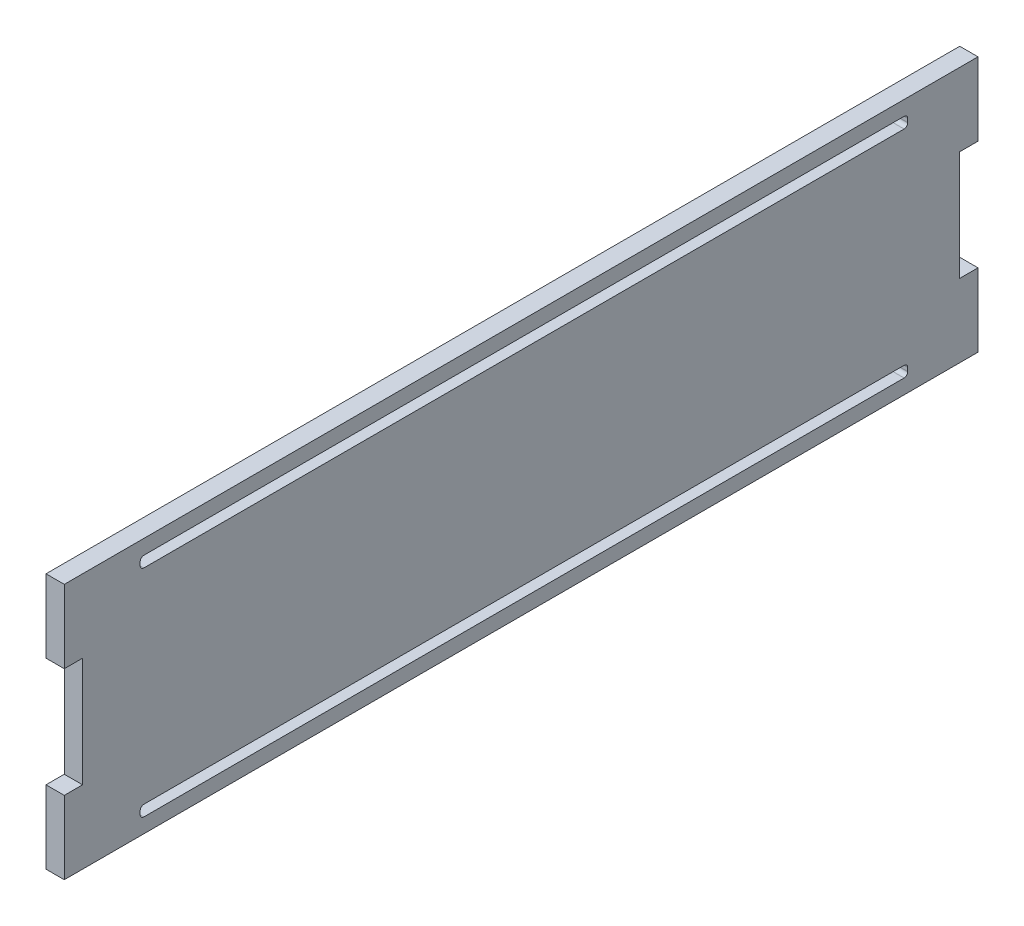
from build123d import *

# Parameters (mm, degrees)
EXTRUDE_1_DEPTH = 5


with BuildPart() as part:
    # 草图1 → 凸台-拉伸1 (new body)
    with BuildSketch(Plane(origin=(0, 0, 0), x_dir=(0, 0, -1), z_dir=(1, 0, 0))):
        Polygon((0, 0), (-250, 0), (-250, 20), (-245, 20), (-245, 50), (-250, 50), (-250, 70), (0, 70), (0, 50), (-5, 50), (-5, 20), (0, 20), align=None)
        with BuildLine():
            Line((-228.2219096, 66), (-20.2219096, 66))
            ThreePointArc((-20.2219096, 66), (-19.514802819, 65.707106781), (-19.2219096, 65))
            Line((-19.2219096, 65), (-19.2219096, 64))
            ThreePointArc((-19.2219096, 64), (-19.514802819, 63.292893219), (-20.2219096, 63))
            Line((-20.2219096, 63), (-228.2219096, 63))
            ThreePointArc((-228.2219096, 63), (-228.929016382, 63.292893219), (-229.2219096, 64))
            Line((-229.2219096, 64), (-229.2219096, 65))
            ThreePointArc((-229.2219096, 65), (-228.929016382, 65.707106781), (-228.2219096, 66))
        make_face(mode=Mode.SUBTRACT)
        with BuildLine():
            Line((-228.2219096, 4), (-20.2219096, 4))
            ThreePointArc((-20.2219096, 4), (-19.514802819, 4.292893219), (-19.2219096, 5))
            Line((-19.2219096, 5), (-19.2219096, 6))
            ThreePointArc((-19.2219096, 6), (-19.514802819, 6.707106781), (-20.2219096, 7))
            Line((-20.2219096, 7), (-228.2219096, 7))
            ThreePointArc((-228.2219096, 7), (-228.929016382, 6.707106781), (-229.2219096, 6))
            Line((-229.2219096, 6), (-229.2219096, 5))
            ThreePointArc((-229.2219096, 5), (-228.929016382, 4.292893219), (-228.2219096, 4))
        make_face(mode=Mode.SUBTRACT)
    extrude(amount=EXTRUDE_1_DEPTH)


solid = part.part
